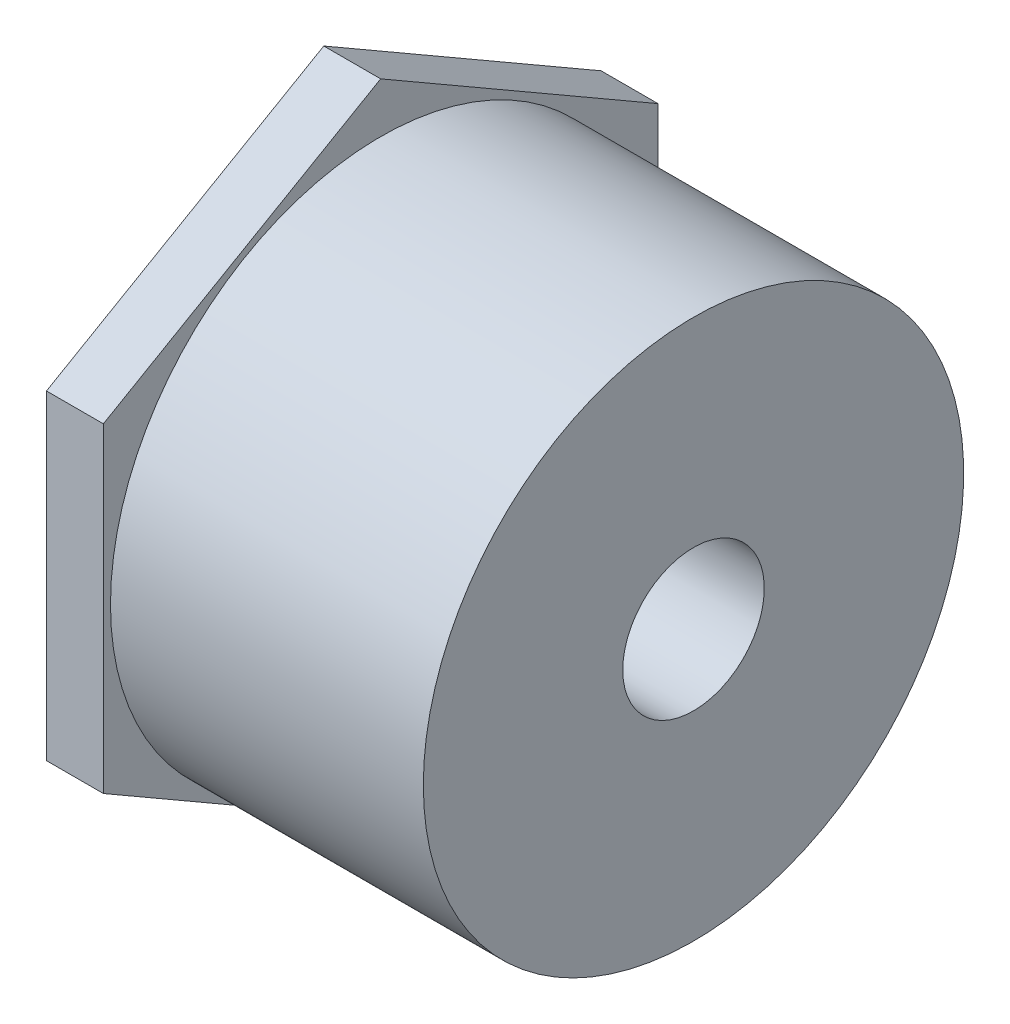
from build123d import *

# Parameters (mm, degrees)
SKETCH2_R           = 10.7696
BOSS_EXTRUDE1_DEPTH = 6.35


with BuildPart() as part:
    # Sketch1 → Revolve1 (revolve)
    with BuildSketch(Plane.XY, mode=Mode.PRIVATE) as revolve1_sk:
        Polygon((-41.275, -30.1625), (0, -30.1625), (0, -7.8994), (-22.225, -7.8994), (-22.225, -10.6172), (-41.275, -10.7696), align=None)
    revolve(revolve1_sk.sketch.rotate(Axis((-41.275, 0, 0), (1, 0, 0)), 270), axis=Axis((-41.275, 0, 0), (1, 0, 0)))

    # Sketch2 → Boss-Extrude1 (add)
    with BuildSketch(Plane.ZY.offset(41.275)):
        Polygon((0, 35.745198541), (-30.95625, 17.872599271), (-30.95625, -17.872599271), (0, -35.745198541), (30.95625, -17.872599271), (30.95625, 17.872599271), align=None)
        Circle(SKETCH2_R, mode=Mode.SUBTRACT)
    extrude(amount=-BOSS_EXTRUDE1_DEPTH)


solid = part.part
